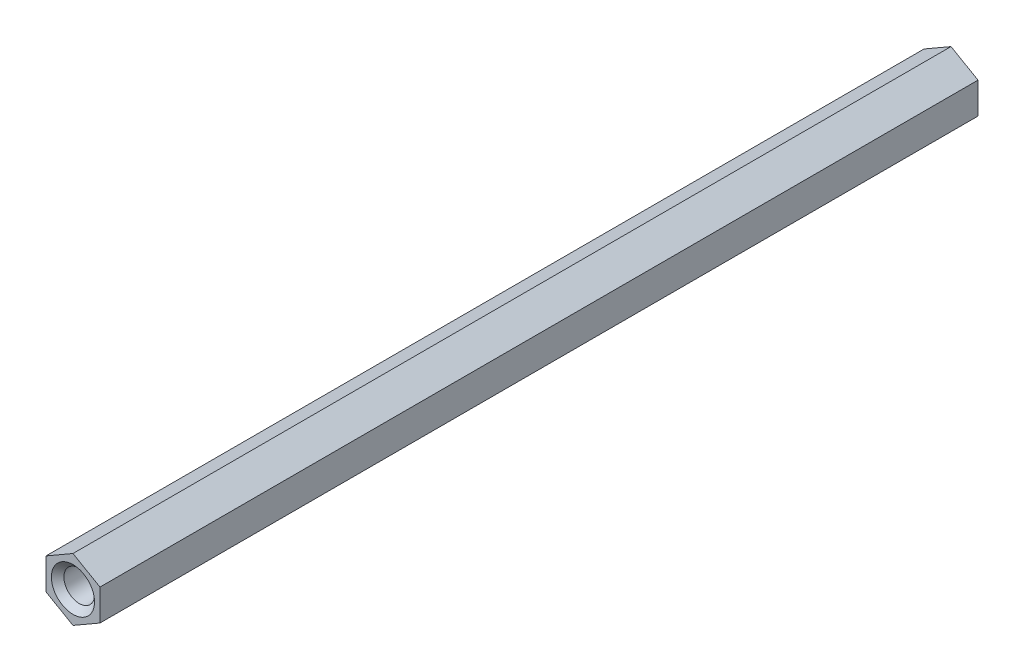
from build123d import *

# Parameters (mm, degrees)
BOSS_EXTRUDE1_DEPTH               = 77.5
F_1_4_28_TAPPED_HOLE1_D           = 5.4102
F_1_4_28_TAPPED_HOLE1_DEPTH       = 15.24
F_1_4_28_TAPPED_HOLE1_CSINK_D     = 7.62
F_1_4_28_TAPPED_HOLE1_CSINK_ANGLE = 90
F_1_4_28_TAPPED_HOLE1_TIP         = 1.625388061
F_1_4_28_TAPPED_HOLE2_D           = 5.4102
F_1_4_28_TAPPED_HOLE2_DEPTH       = 17.2339
F_1_4_28_TAPPED_HOLE2_CSINK_D     = 7.62
F_1_4_28_TAPPED_HOLE2_CSINK_ANGLE = 90
F_1_4_28_TAPPED_HOLE2_TIP         = 1.625388061


with BuildPart() as part:
    # Sketch3 → Boss-Extrude1 (new, symmetric)
    with BuildSketch(Plane.XY):
        Polygon((0, 5.499261314), (4.7625, 2.749630657), (4.7625, -2.749630657), (0, -5.499261314), (-4.7625, -2.749630657), (-4.7625, 2.749630657), align=None)
    extrude(amount=BOSS_EXTRUDE1_DEPTH, both=True)

    # 1/4-28 Tapped Hole1
    with Locations(Plane.XY.offset(77.5)):
        with Locations((0, 0)):
            CounterSinkHole(F_1_4_28_TAPPED_HOLE1_D / 2, F_1_4_28_TAPPED_HOLE1_CSINK_D / 2, depth=F_1_4_28_TAPPED_HOLE1_DEPTH, counter_sink_angle=F_1_4_28_TAPPED_HOLE1_CSINK_ANGLE)
            with Locations((0, 0, -(F_1_4_28_TAPPED_HOLE1_DEPTH + F_1_4_28_TAPPED_HOLE1_TIP / 2))):  # 118° drill point
                Cone(0, F_1_4_28_TAPPED_HOLE1_D / 2, F_1_4_28_TAPPED_HOLE1_TIP, mode=Mode.SUBTRACT)

    # 1/4-28 Tapped Hole2
    with Locations(Plane(origin=(0, 0, -77.5), x_dir=(-1, 0, 0), z_dir=(0, 0, -1))):
        with Locations((0, 0)):
            CounterSinkHole(F_1_4_28_TAPPED_HOLE2_D / 2, F_1_4_28_TAPPED_HOLE2_CSINK_D / 2, depth=F_1_4_28_TAPPED_HOLE2_DEPTH, counter_sink_angle=F_1_4_28_TAPPED_HOLE2_CSINK_ANGLE)
            with Locations((0, 0, -(F_1_4_28_TAPPED_HOLE2_DEPTH + F_1_4_28_TAPPED_HOLE2_TIP / 2))):  # 118° drill point
                Cone(0, F_1_4_28_TAPPED_HOLE2_D / 2, F_1_4_28_TAPPED_HOLE2_TIP, mode=Mode.SUBTRACT)


solid = part.part
